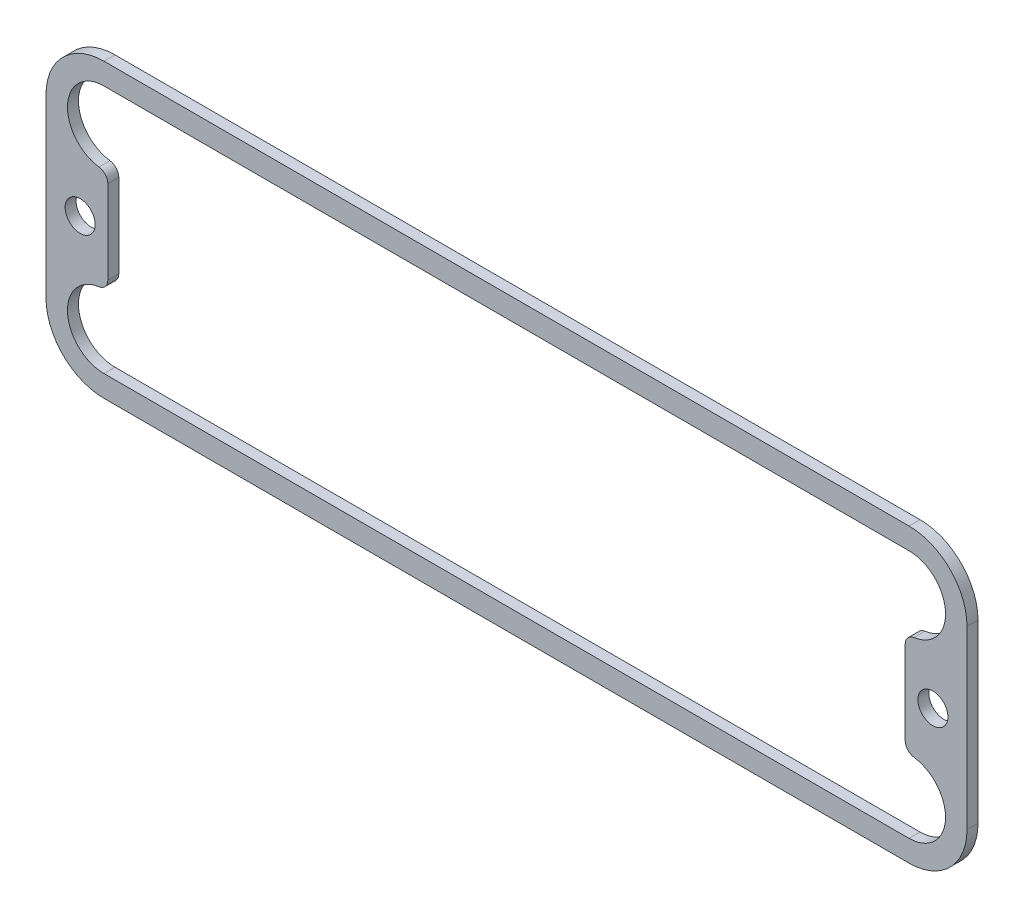
from build123d import *

# Parameters (mm, degrees)
SKETCH2_R           = 0.889
BOSS_EXTRUDE1_DEPTH = 0.65


with BuildPart() as part:
    # Sketch2 → Boss-Extrude1 (new body)
    with BuildSketch(Plane.XY.offset(0.635)):
        with BuildLine():
            Line((23.8125, 8.636), (-23.8125, 8.636))
            ThreePointArc((-23.8125, 8.636), (-26.237169153, 7.631669153), (-27.2415, 5.207))
            Line((-27.2415, 5.207), (-27.2415, -5.207))
            ThreePointArc((-27.2415, -5.207), (-26.237169153, -7.631669153), (-23.8125, -8.636))
            Line((-23.8125, -8.636), (23.8125, -8.636))
            ThreePointArc((23.8125, -8.636), (26.237169153, -7.631669153), (27.2415, -5.207))
            Line((27.2415, -5.207), (27.2415, 5.207))
            ThreePointArc((27.2415, 5.207), (26.237169153, 7.631669153), (23.8125, 8.636))
        make_face()
        with Locations((-25.223, 0)):
            Circle(SKETCH2_R, mode=Mode.SUBTRACT)
        with Locations((25.223, 0)):
            Circle(SKETCH2_R, mode=Mode.SUBTRACT)
        with BuildLine():
            Line((23.5855, -2.470494747), (23.5855, 2.470494747))
            ThreePointArc((23.5855, 2.470494747), (23.734063659, 2.866942592), (24.10658046, 3.068122331))
            ThreePointArc((24.10658046, 3.068122331), (25.966463543, 5.354384043), (23.8125, 7.366))
            Line((23.8125, 7.366), (-23.8125, 7.366))
            ThreePointArc((-23.8125, 7.366), (-25.966463543, 5.354384043), (-24.10658046, 3.068122331))
            ThreePointArc((-24.10658046, 3.068122331), (-23.734063659, 2.866942592), (-23.5855, 2.470494747))
            Line((-23.5855, 2.470494747), (-23.5855, -2.470494747))
            ThreePointArc((-23.5855, -2.470494747), (-23.734063659, -2.866942592), (-24.10658046, -3.068122331))
            ThreePointArc((-24.10658046, -3.068122331), (-25.966463543, -5.354384043), (-23.8125, -7.366))
            Line((-23.8125, -7.366), (23.8125, -7.366))
            ThreePointArc((23.8125, -7.366), (25.966463543, -5.354384043), (24.10658046, -3.068122331))
            ThreePointArc((24.10658046, -3.068122331), (23.734063659, -2.866942592), (23.5855, -2.470494747))
        make_face(mode=Mode.SUBTRACT)
    extrude(amount=BOSS_EXTRUDE1_DEPTH)


solid = part.part
